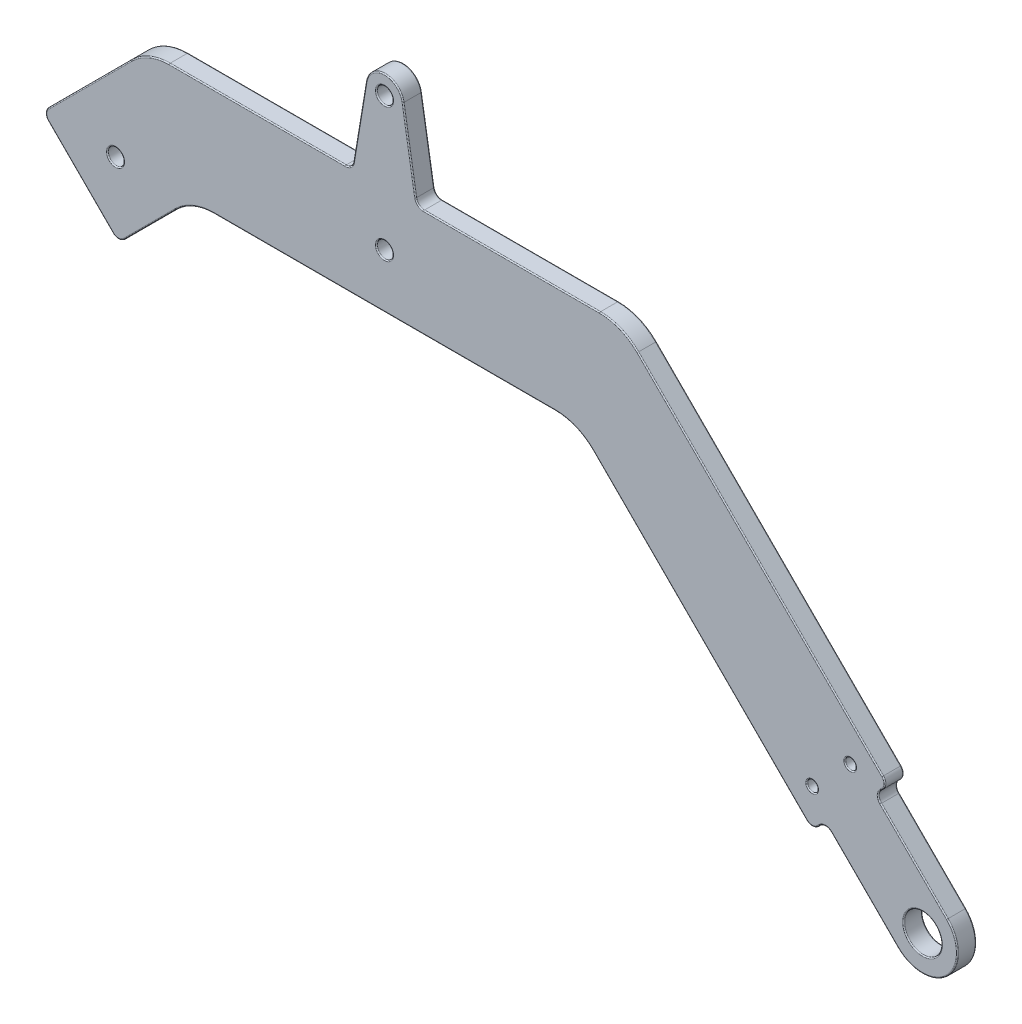
from build123d import *

# Parameters (mm, degrees)
SKETCH5_R           = 1
SKETCH5_R_2         = 3.5
SKETCH5_R_3         = 1.5
BOSS_EXTRUDE1_DEPTH = 3.5
FILLET1_R           = 10
FILLET2_R           = 1.5
FILLET3_R           = 0.2


with BuildPart() as part:
    # Sketch5 → Boss-Extrude1 (new body)
    with BuildSketch(Plane.XY):
        with BuildLine():
            Line((81.96877708, 8.838834765), (95.403805922, -4.596194078))
            ThreePointArc((95.403805922, -4.596194078), (104.596194078, -4.596194078), (104.596194078, 4.596194078))
            Line((104.596194078, 4.596194078), (91.161165235, 18.03122292))
            Line((91.161165235, 18.03122292), (93.636038969, 20.506096654))
            Line((93.636038969, 20.506096654), (44.142135624, 70))
            Line((44.142135624, 70), (6, 70))
            Line((6, 70), (3.453220204, 85.420324662))
            ThreePointArc((3.453220204, 85.420324662), (0, 88.35), (-3.453220204, 85.420324662))
            Line((-3.453220204, 85.420324662), (-6, 70))
            Line((-6, 70), (-44.142135624, 70))
            Line((-44.142135624, 70), (-63.587572106, 50.554563517))
            Line((-63.587572106, 50.554563517), (-49.445436483, 36.412427894))
            Line((-49.445436483, 36.412427894), (-35.857864376, 50))
            Line((-35.857864376, 50), (35.857864376, 50))
            Line((35.857864376, 50), (79.493903346, 6.363961031))
            Line((79.493903346, 6.363961031), (81.96877708, 8.838834765))
        make_face()
        with Locations((86.564971157, 20.506096654)):
            Circle(SKETCH5_R, mode=Mode.SUBTRACT)
        with Locations((79.493903346, 13.435028843)):
            Circle(SKETCH5_R, mode=Mode.SUBTRACT)
        with Locations((100, 0)):
            Circle(SKETCH5_R_2, mode=Mode.SUBTRACT)
        with Locations((0, 84.85)):
            Circle(SKETCH5_R_3, mode=Mode.SUBTRACT)
        with Locations((0, 60)):
            Circle(SKETCH5_R_3, mode=Mode.SUBTRACT)
        with Locations((-50, 50)):
            Circle(SKETCH5_R_3, mode=Mode.SUBTRACT)
    extrude(amount=BOSS_EXTRUDE1_DEPTH)

    # Fillet1
    fillet1_edges = [part.edges().sort_by_distance(p)[0] for p in [
        (44.142135624, 70, 1.75),
        (35.857864376, 50, 1.75),
        (-35.857864376, 50, 1.75),
        (-44.142135624, 70, 1.75),
    ]]
    fillet(fillet1_edges, radius=FILLET1_R)

    # Fillet2
    fillet2_edges = [part.edges().sort_by_distance(p)[0] for p in [
        (93.636038969, 20.506096654, 1.75),
        (91.161165235, 18.03122292, 1.75),
        (81.96877708, 8.838834765, 1.75),
        (79.493903346, 6.363961031, 1.75),
        (-49.445436483, 36.412427894, 1.75),
        (-63.587572106, 50.554563517, 1.75),
        (-6, 70, 1.75),
        (6, 70, 1.75),
    ]]
    fillet(fillet2_edges, radius=FILLET2_R)

    # Fillet3
    fillet3_edges = [part.edges().sort_by_distance(p)[0] for p in [
        (-43.585786438, 42.272077939, 0),
        (-43.585786438, 42.272077939, 3.5),
        (69.823223305, 44.318912319, 0),
        (92.398602102, 19.268659787, 0),
        (89.216621587, 1.590990258, 0),
        (80.731340213, 7.601397898, 0),
        (-56.516504294, 43.483495706, 0),
        (-23.636292033, 70, 0),
        (4.622926377, 78.337949903, 0),
        (79.493903346, 6.985281374, 0),
        (93.014718626, 20.506096654, 0),
        (-62.966251763, 50.554563517, 0),
        (-49.445436483, 37.033748237, 0),
        (-56.516504294, 43.483495706, 3.5),
        (69.823223305, 44.318912319, 3.5),
        (4.622926377, 78.337949903, 3.5),
        (-23.636292033, 70, 3.5),
        (80.731340213, 7.601397898, 3.5),
        (89.216621587, 1.590990258, 3.5),
        (92.398602102, 19.268659787, 3.5),
        (79.493903346, 6.985281374, 3.5),
        (93.014718626, 20.506096654, 3.5),
        (-62.966251763, 50.554563517, 3.5),
        (-49.445436483, 37.033748237, 3.5),
        (-6.302181387, 70.356182427, 0),
        (-6.302181387, 70.356182427, 3.5),
        (6.302181387, 70.356182427, 0),
        (6.302181387, 70.356182427, 3.5),
        (91.782485579, 18.03122292, 0),
        (91.782485579, 18.03122292, 3.5),
        (81.96877708, 8.217514421, 0),
        (81.96877708, 8.217514421, 3.5),
        (0, 88.35, 3.5),
        (98.409009742, 10.783378413, 0),
        (-4.622926377, 78.337949903, 3.5),
        (104.596194078, -4.596194078, 0),
        (-4.622926377, 78.337949903, 0),
        (0, 88.35, 0),
        (85.564971157, 20.506096654, 0),
        (85.564971157, 20.506096654, 3.5),
        (78.493903346, 13.435028843, 0),
        (78.493903346, 13.435028843, 3.5),
        (96.5, 0, 0),
        (96.5, 0, 3.5),
        (-1.5, 84.85, 0),
        (-1.5, 84.85, 3.5),
        (104.596194078, -4.596194078, 3.5),
        (-1.5, 60, 0),
        (-1.5, 60, 3.5),
        (98.409009742, 10.783378413, 3.5),
        (-51.5, 50, 0),
        (-51.5, 50, 3.5),
        (58.610019869, 27.247844507, 0),
        (58.610019869, 27.247844507, 3.5),
        (0, 50, 0),
        (0, 50, 3.5),
        (23.636292033, 70, 0),
        (23.636292033, 70, 3.5),
        (-54.798989873, 59.343145751, 0),
        (-43.826834324, 69.238795325, 0),
        (43.826834324, 69.238795325, 0),
        (-54.798989873, 59.343145751, 3.5),
        (-43.826834324, 69.238795325, 3.5),
        (43.826834324, 69.238795325, 3.5),
        (35.542563076, 49.238795325, 0),
        (35.542563076, 49.238795325, 3.5),
        (-35.542563076, 49.238795325, 0),
        (-35.542563076, 49.238795325, 3.5),
    ]]
    fillet(fillet3_edges, radius=FILLET3_R)


solid = part.part
